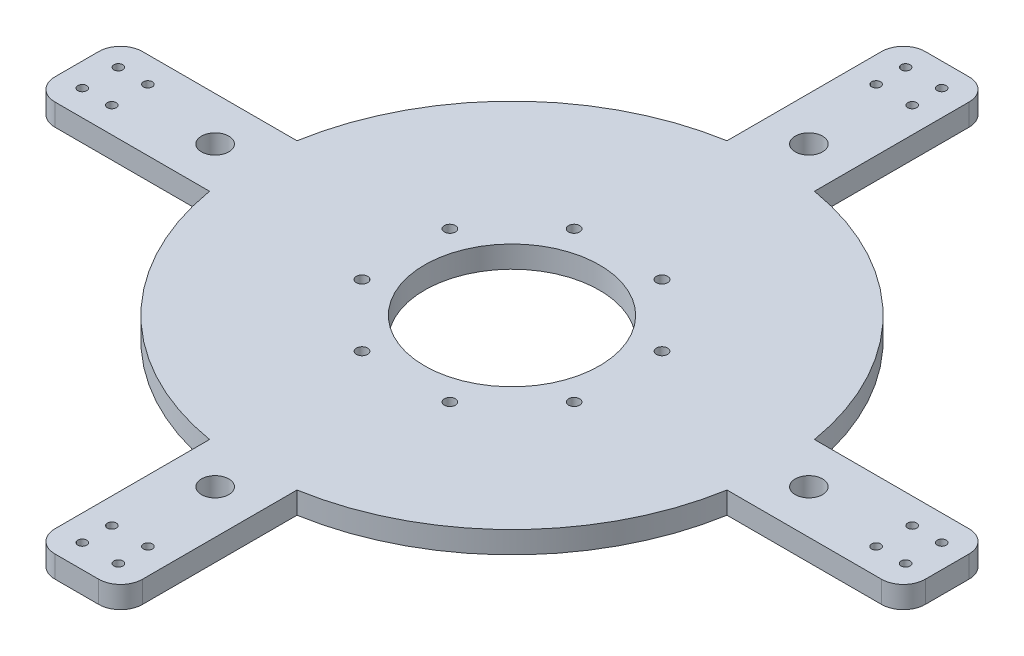
from build123d import *

# Parameters (mm, degrees)
SKETCH1_R           = 200
BOSS_EXTRUDE1_DEPTH = 10
SKETCH2_R           = 6.25
CUT_EXTRUDE1_DEPTH  = 284.019433962
SKETCH4_R           = 2.55
CUT_EXTRUDE2_DEPTH  = 284.019433962
CIRPATTERN1_COUNT   = 8
SKETCH5_R           = 2.05
CUT_EXTRUDE3_DEPTH  = 284.019433962
CIRPATTERN2_COUNT   = 4
CUT_EXTRUDE4_START  = -10
CUT_EXTRUDE4_DEPTH  = 10
CIRPATTERN3_COUNT   = 4
SKETCH7_R           = 40
CUT_EXTRUDE5_DEPTH  = 282.602556807
FILLET1_R           = 10


with BuildPart() as part:
    # Sketch1 → Boss-Extrude1 (new body)
    with BuildSketch(Plane(origin=(0, 0, 0), x_dir=(1, 0, 0), z_dir=(0, 1, 0))):
        with Locations(Location((0, 0, 0), (0, 0, 270))):
            Circle(SKETCH1_R)
    extrude(amount=BOSS_EXTRUDE1_DEPTH)

    # Sketch2 → Cut-Extrude1 (cut, through all)
    with BuildSketch(Plane(origin=(0, 10, 0), x_dir=(1, 0, 0), z_dir=(0, 1, 0))):
        with Locations(Location((-135.764501988, 0, 0), (0, 0, 270))):
            Circle(SKETCH2_R)
        with Locations(Location((0, -135.764501988, 0), (0, 0, 270))):
            Circle(SKETCH2_R)
        with Locations(Location((135.764501988, 0, 0), (0, 0, 270))):
            Circle(SKETCH2_R)
        with Locations(Location((0, 135.764501988, 0), (0, 0, 270))):
            Circle(SKETCH2_R)
    extrude(amount=-CUT_EXTRUDE1_DEPTH, mode=Mode.SUBTRACT)

    # Sketch4 → Cut-Extrude2 (cut, through all)
    with BuildSketch(Plane(origin=(0, 10, 0), x_dir=(1, 0, 0), z_dir=(0, 1, 0))):
        with Locations(Location((20.090880199, 48.503675457, 0), (0, 0, 270))):
            Circle(SKETCH4_R)
    cut_extrude2 = extrude(amount=-CUT_EXTRUDE2_DEPTH, mode=Mode.SUBTRACT)

    # CirPattern1: Cut-Extrude2 ×8 about axis
    cirpattern1_axis = Axis((0, 0, 0), (0, 1, 0))
    for i in range(1, CIRPATTERN1_COUNT):
        add(cut_extrude2.rotate(cirpattern1_axis, i * 360 / CIRPATTERN1_COUNT), mode=Mode.SUBTRACT)

    # Sketch5 → Cut-Extrude3 (cut, through all)
    with BuildSketch(Plane(origin=(0, 10, 0), x_dir=(1, 0, 0), z_dir=(0, 1, 0))):
        with Locations(Location((-188.264501988, 8.25, 0), (0, 0, 270))):
            Circle(SKETCH5_R)
        with Locations(Location((-174.764501988, 8.25, 0), (0, 0, 270))):
            Circle(SKETCH5_R)
        with Locations(Location((-174.764501988, -8.25, 0), (0, 0, 270))):
            Circle(SKETCH5_R)
        with Locations(Location((-188.264501988, -8.25, 0), (0, 0, 270))):
            Circle(SKETCH5_R)
    cut_extrude3 = extrude(amount=-CUT_EXTRUDE3_DEPTH, mode=Mode.SUBTRACT)

    # CirPattern2: Cut-Extrude3 ×4 about axis
    cirpattern2_axis = Axis((0, 0, 0), (0, 1, 0))
    for i in range(1, CIRPATTERN2_COUNT):
        add(cut_extrude3.rotate(cirpattern2_axis, i * 360 / CIRPATTERN2_COUNT), mode=Mode.SUBTRACT)

    # Sketch6 → Cut-Extrude4 (cut)
    with BuildSketch(Plane(origin=(0, 10, 0), x_dir=(1, 0, 0), z_dir=(0, 1, 0)).offset(CUT_EXTRUDE4_START)):
        with BuildLine():
            Line((-198.997487421, 20), (-118.321595662, 20))
            ThreePointArc((-118.321595662, 20), (-84.852813742, 84.852813742), (-20, 118.321595662))
            Line((-20, 118.321595662), (-20, 198.997487421))
            ThreePointArc((-20, 198.997487421), (-141.421356237, 141.421356237), (-198.997487421, 20))
        make_face()
        with BuildLine():
            Line((-198.997487421, -20), (-198.997487421, 20))
            ThreePointArc((-198.997487421, 20), (-200, 0), (-198.997487421, -20))
        make_face()
    cut_extrude4 = extrude(amount=CUT_EXTRUDE4_DEPTH, mode=Mode.SUBTRACT)

    # CirPattern3: Cut-Extrude4 ×4 about axis
    cirpattern3_axis = Axis((0, 0, 0), (0, 1, 0))
    for i in range(1, CIRPATTERN3_COUNT):
        add(cut_extrude4.rotate(cirpattern3_axis, i * 360 / CIRPATTERN3_COUNT), mode=Mode.SUBTRACT)

    # Sketch7 → Cut-Extrude5 (cut, through all)
    with BuildSketch(Plane(origin=(0, 10, 0), x_dir=(1, 0, 0), z_dir=(0, 1, 0))):
        with Locations(Location((0, 0, 0), (0, 0, 270))):
            Circle(SKETCH7_R)
    extrude(amount=-CUT_EXTRUDE5_DEPTH, mode=Mode.SUBTRACT)

    # Fillet1
    fillet1_edges = [part.edges().sort_by_distance(p)[0] for p in [
        (-198.997487421, 5, -20),
        (-20, 5, -198.997487421),
        (-198.997487421, 5, 20),
        (-20, 5, 198.997487421),
        (198.997487421, 5, 20),
        (20, 5, -198.997487421),
        (20, 5, 198.997487421),
        (198.997487421, 5, -20),
    ]]
    fillet(fillet1_edges, radius=FILLET1_R)


solid = part.part
